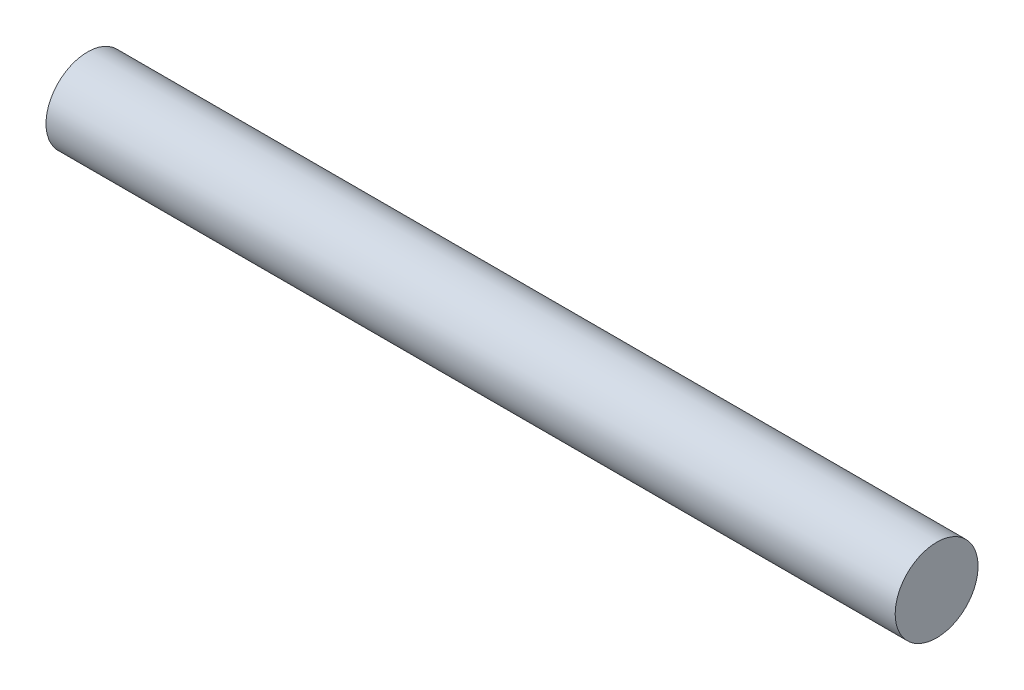
from build123d import *

# Parameters (mm, degrees)
SKETCH1_R           = 1.5
BOSS_EXTRUDE1_DEPTH = 30.73


with BuildPart() as part:
    # Sketch1 → Boss-Extrude1 (new body)
    with BuildSketch(Plane(origin=(0, 0, 0), x_dir=(0, 0, -1), z_dir=(1, 0, 0))):
        with Locations(Location((0, 0, 0), (0, 0, 180))):
            Circle(SKETCH1_R)
    extrude(amount=BOSS_EXTRUDE1_DEPTH)


solid = part.part
